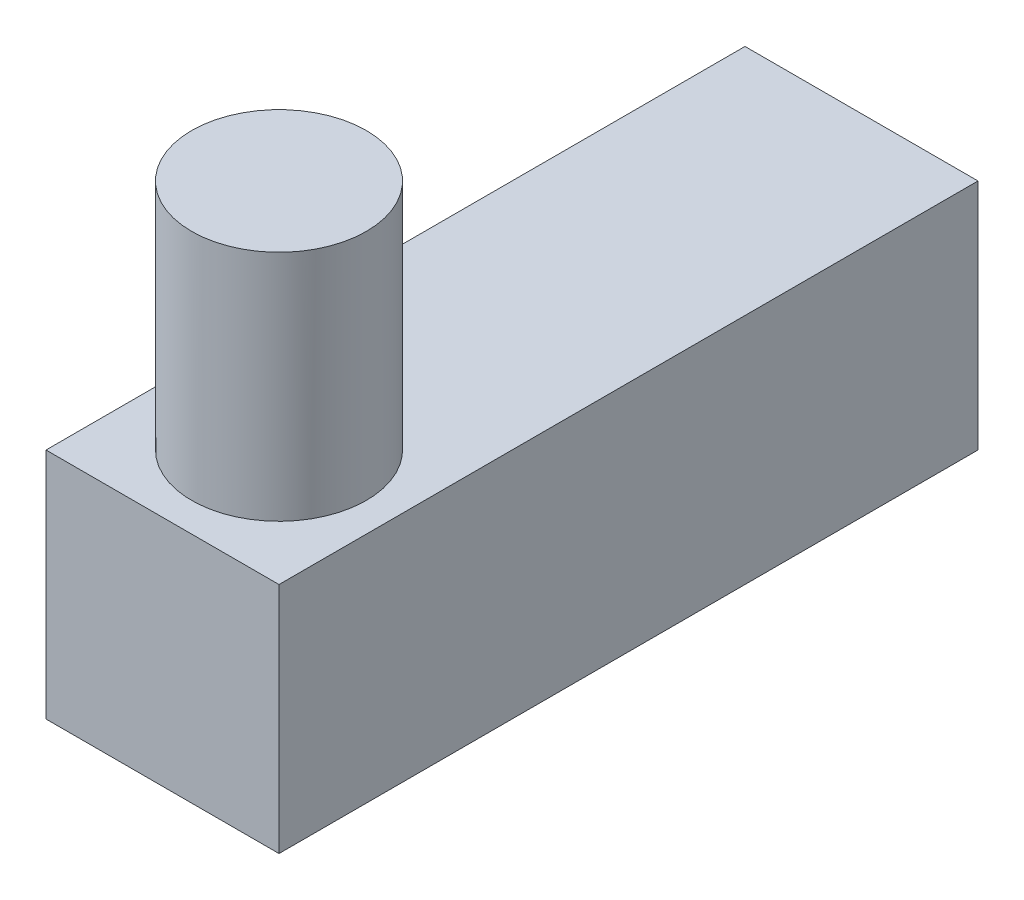
from build123d import *

# Parameters (mm, degrees)
SKETCH1_W           = 101.6
SKETCH1_H           = 304.8
BOSS_EXTRUDE1_DEPTH = 101.6
SKETCH2_R           = 38.1
BOSS_EXTRUDE2_DEPTH = 101.6


with BuildPart() as part:
    # Sketch1 → Boss-Extrude1 (new body)
    with BuildSketch(Plane(origin=(0, 0, 0), x_dir=(1, 0, 0), z_dir=(0, 1, 0))):
        with Locations((50.8, 152.4)):
            Rectangle(SKETCH1_W, SKETCH1_H)
    extrude(amount=BOSS_EXTRUDE1_DEPTH)

    # Sketch2 → Boss-Extrude2 (add)
    with BuildSketch(Plane(origin=(0, 101.6, 0), x_dir=(1, 0, 0), z_dir=(0, 1, 0))):
        with Locations(Location((50.8, 50.8, 0), (0, 0, 90))):
            Circle(SKETCH2_R)
    extrude(amount=BOSS_EXTRUDE2_DEPTH)


solid = part.part
